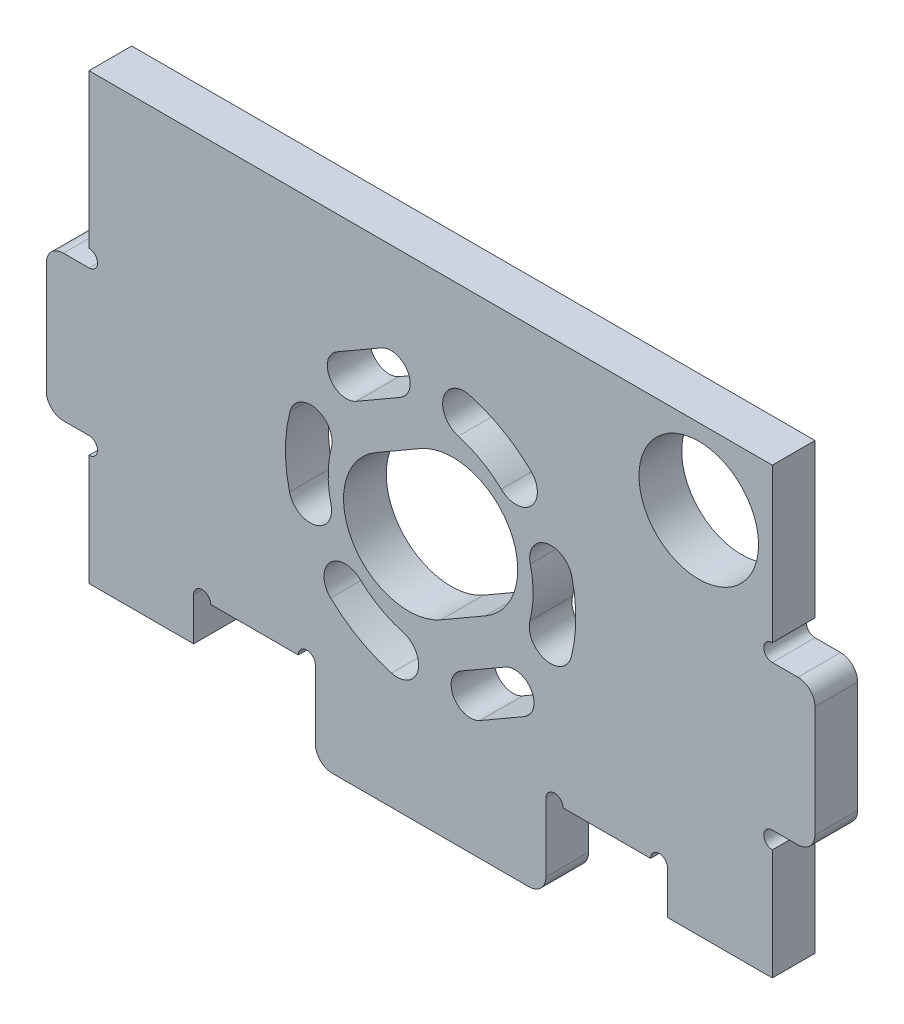
from build123d import *

# Parameters (mm, degrees)
SKETCH_1_W          = 80
SKETCH_1_H          = 52
EXTRUDE_1_DEPTH     = 5
CUT_EXTRUDE_1_DEPTH = 5
SKETCH_3_R          = 7
CUT_EXTRUDE_2_DEPTH = 10
SKETCH_10_W         = 27
SKETCH_10_H         = 5
SKETCH_10_W_2       = 5
SKETCH_10_H_2       = 17
EXTRUDE_3_DEPTH     = 5
SKETCH_11_R         = 1
CUT_EXTRUDE_5_DEPTH = 5
FILLET_1_R          = 2
SKETCH_12_W         = 14.25
SKETCH_12_H         = 5
CUT_EXTRUDE_6_DEPTH = 10
SKETCH_15_R         = 1
CUT_EXTRUDE_7_DEPTH = 10


with BuildPart() as part:
    # 스케치1 → 보스-돌출1 (new body)
    with BuildSketch(Plane.XY):
        with Locations((-2.598076211, 25)):
            Rectangle(SKETCH_1_W, SKETCH_1_H)
        with BuildLine():
            Line((-8.996152423, 29.081793069), (-3.8, 32.081793069))
            ThreePointArc((-3.8, 32.081793069), (6.581793069, 29.3), (3.8, 18.918206931))
            Line((3.8, 18.918206931), (-1.396152423, 15.918206931))
            ThreePointArc((-1.396152423, 15.918206931), (-11.777945491, 18.7), (-8.996152423, 29.081793069))
        make_face(mode=Mode.SUBTRACT)
        with BuildLine():
            ThreePointArc((9.118681917, 36.317368995), (5.799069268, 38.781337822), (1.982863658, 40.371163365))
            ThreePointArc((1.982863658, 40.371163365), (-1.098327994, 38.637306968), (0.635528403, 35.556115316))
            ThreePointArc((0.635528403, 35.556115316), (3.329320598, 34.433885521), (5.672576585, 32.694613408))
            ThreePointArc((5.672576585, 32.694613408), (9.207007044, 32.782938536), (9.118681917, 36.317368995))
        make_face(mode=Mode.SUBTRACT)
        with BuildLine():
            ThreePointArc((13.92745731, 27.988325692), (14.401510584, 23.881472394), (13.870237087, 19.781628618))
            ThreePointArc((13.870237087, 19.781628618), (10.828077575, 17.980166572), (9.026615528, 21.022326083))
            ThreePointArc((9.026615528, 21.022326083), (9.401632115, 23.916333454), (9.067006275, 26.815288723))
            ThreePointArc((9.067006275, 26.815288723), (10.910713308, 29.832032725), (13.92745731, 27.988325692))
        make_face(mode=Mode.SUBTRACT)
        with BuildLine():
            ThreePointArc((-14.31483434, 11.682631005), (-10.995221691, 9.218662178), (-7.179016081, 7.628836635))
            ThreePointArc((-7.179016081, 7.628836635), (-4.097824429, 9.362693032), (-5.831680825, 12.443884684))
            ThreePointArc((-5.831680825, 12.443884684), (-8.52547302, 13.566114479), (-10.868729008, 15.305386592))
            ThreePointArc((-10.868729008, 15.305386592), (-14.403159467, 15.217061464), (-14.31483434, 11.682631005))
        make_face(mode=Mode.SUBTRACT)
        with BuildLine():
            ThreePointArc((-19.123609733, 20.011674308), (-19.597663007, 24.118527606), (-19.066389509, 28.218371382))
            ThreePointArc((-19.066389509, 28.218371382), (-16.024229998, 30.019833428), (-14.222767951, 26.977673917))
            ThreePointArc((-14.222767951, 26.977673917), (-14.597784537, 24.083666546), (-14.263158697, 21.184711277))
            ThreePointArc((-14.263158697, 21.184711277), (-16.106865731, 18.167967275), (-19.123609733, 20.011674308))
        make_face(mode=Mode.SUBTRACT)
    extrude(amount=EXTRUDE_1_DEPTH)

    # 스케치2 → 컷-돌출1 (cut)
    with BuildSketch(Plane.XY.offset(5)):
        with BuildLine():
            Line((8.375, 10.994074487), (3.178847577, 7.994074487))
            ThreePointArc((3.178847577, 7.994074487), (0.105290419, 8.817631645), (0.928847577, 11.891188804))
            Line((0.928847577, 11.891188804), (6.125, 14.891188804))
            ThreePointArc((6.125, 14.891188804), (9.198557159, 14.067631645), (8.375, 10.994074487))
        make_face()
        with BuildLine():
            Line((-6.125, 36.108811196), (-11.321152423, 33.108811196))
            ThreePointArc((-11.321152423, 33.108811196), (-14.394709581, 33.932368355), (-13.571152423, 37.005925513))
            Line((-13.571152423, 37.005925513), (-8.375, 40.005925513))
            ThreePointArc((-8.375, 40.005925513), (-5.301442841, 39.182368355), (-6.125, 36.108811196))
        make_face()
    extrude(amount=-CUT_EXTRUDE_1_DEPTH, mode=Mode.SUBTRACT)

    # 스케치3 → 컷-돌출2 (cut)
    with BuildSketch(Plane.XY.offset(5)):
        with Locations((28.795344676, 42.125)):
            Circle(SKETCH_3_R)
    extrude(amount=-CUT_EXTRUDE_2_DEPTH, mode=Mode.SUBTRACT)

    # 스케치10 → 보스-돌출3 (add)
    with BuildSketch(Plane.XY.offset(5)):
        with Locations((-2.598076211, -3.5)):
            Rectangle(SKETCH_10_W, SKETCH_10_H)
        with Locations((39.901923789, 22.5)):
            Rectangle(SKETCH_10_W_2, SKETCH_10_H_2)
        with Locations((-45.098076211, 22.5)):
            Rectangle(SKETCH_10_W_2, SKETCH_10_H_2)
    extrude(amount=-EXTRUDE_3_DEPTH)

    # 스케치11 → 컷-돌출5 (cut)
    with BuildSketch(Plane.XY.offset(5)):
        with Locations((37.401923789, 32)):
            Circle(SKETCH_11_R)
        with Locations((37.401923789, 13)):
            Circle(SKETCH_11_R)
        with Locations((-42.598076211, 13)):
            Circle(SKETCH_11_R)
        with Locations((-42.598076211, 32)):
            Circle(SKETCH_11_R)
        with Locations((11.901923789, -1)):
            Circle(SKETCH_11_R)
        with Locations((-17.098076211, -1)):
            Circle(SKETCH_11_R)
    extrude(amount=-CUT_EXTRUDE_5_DEPTH, mode=Mode.SUBTRACT)

    # 필렛1
    fillet_1_edges = [part.edges().sort_by_distance(p)[0] for p in [
        (42.401923789, 31, 2.5),
        (42.401923789, 14, 2.5),
        (10.901923789, -6, 2.5),
        (-16.098076211, -6, 2.5),
        (-47.598076211, 14, 2.5),
        (-47.598076211, 31, 2.5),
    ]]
    fillet(fillet_1_edges, radius=FILLET_1_R)

    # 스케치12 → 컷-돌출6 (cut)
    with BuildSketch(Plane.XY.offset(5)):
        with Locations((18.026923789, 1.5)):
            Rectangle(SKETCH_12_W, SKETCH_12_H)
        with Locations((-23.223076211, 1.5)):
            Rectangle(SKETCH_12_W, SKETCH_12_H)
    extrude(amount=-CUT_EXTRUDE_6_DEPTH, mode=Mode.SUBTRACT)

    # 스케치15 → 컷-돌출7 (cut)
    with BuildSketch(Plane.XY.offset(5)):
        with Locations((11.901923789, 4)):
            Circle(SKETCH_15_R)
        with Locations((24.151923789, 4)):
            Circle(SKETCH_15_R)
        with Locations((-17.098076211, 4)):
            Circle(SKETCH_15_R)
        with Locations((-29.348076211, 4)):
            Circle(SKETCH_15_R)
    extrude(amount=-CUT_EXTRUDE_7_DEPTH, mode=Mode.SUBTRACT)


solid = part.part
